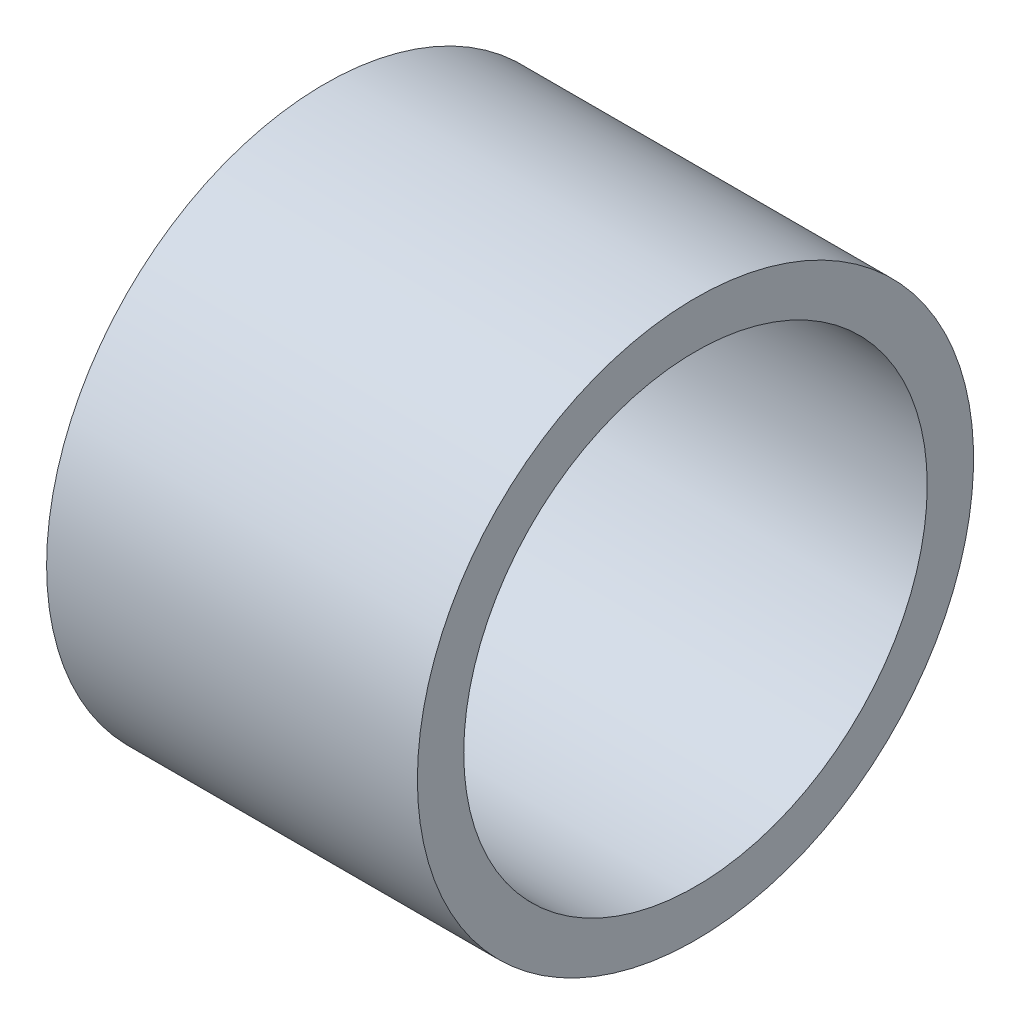
from build123d import *

# Parameters (mm, degrees)
SZKIC1_W = 16
SZKIC1_H = 2


with BuildPart() as part:
    # Szkic1 → Obrót1 (revolve)
    with BuildSketch(Plane.XY, mode=Mode.PRIVATE) as obr_t1_sk:
        with Locations((-21, 11)):
            Rectangle(SZKIC1_W, SZKIC1_H)
    revolve(obr_t1_sk.sketch.rotate(Axis((-26.669624201, 0, 0), (1, 0, 0)), 90), axis=Axis((-26.669624201, 0, 0), (1, 0, 0)))


solid = part.part
